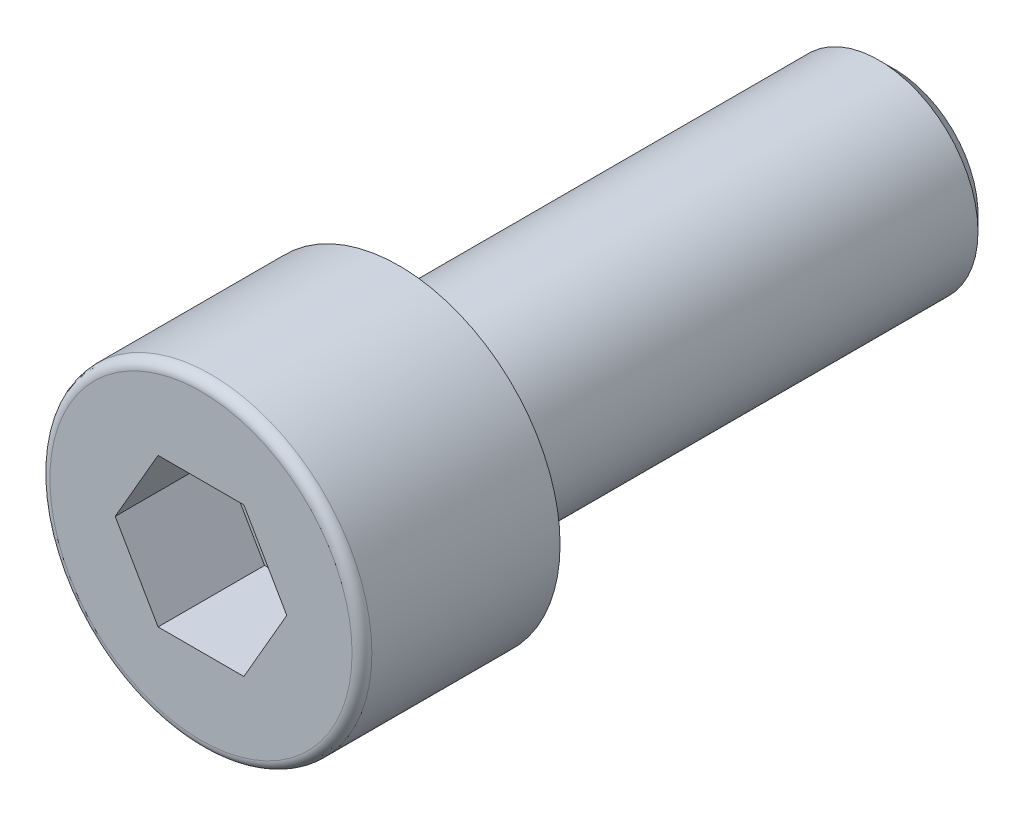
from build123d import *

# Parameters (mm, degrees)
CUT_EXTRUDE1_DEPTH = 4.3
CHAMFER1_SIZE      = 0.625


with BuildPart() as part:
    # Sketch1 → Revolve1 (revolve)
    with BuildSketch(Plane.XZ, mode=Mode.PRIVATE) as revolve1_sk:
        with BuildLine():
            Line((0, -20), (-4, -20))
            Line((-4, -20), (-4, 0))
            Line((-4, 0), (-6.5, 0))
            Line((-6.5, 0), (-6.5, 7.6))
            ThreePointArc((-6.5, 7.6), (-6.382842712, 7.882842712), (-6.1, 8))
            Line((-6.1, 8), (0, 8))
            Line((0, 8), (0, -20))
        make_face()
    revolve(revolve1_sk.sketch.rotate(Axis((0, 0, 8), (0, 0, -1)), 180), axis=Axis((0, 0, 8), (0, 0, -1)))

    # Sketch2 → Cut-Extrude1 (cut)
    with BuildSketch(Plane.XY.offset(8)):
        Polygon((3.464101615, 0), (1.732050808, 3), (-1.732050808, 3), (-3.464101615, 0), (-1.732050808, -3), (1.732050808, -3), align=None)
    extrude(amount=-CUT_EXTRUDE1_DEPTH, mode=Mode.SUBTRACT)

    # Chamfer1
    chamfer1_edges = [part.edges().sort_by_distance(p)[0] for p in [
        (-4, 0, -20),
    ]]
    chamfer(chamfer1_edges, length=CHAMFER1_SIZE)


solid = part.part
